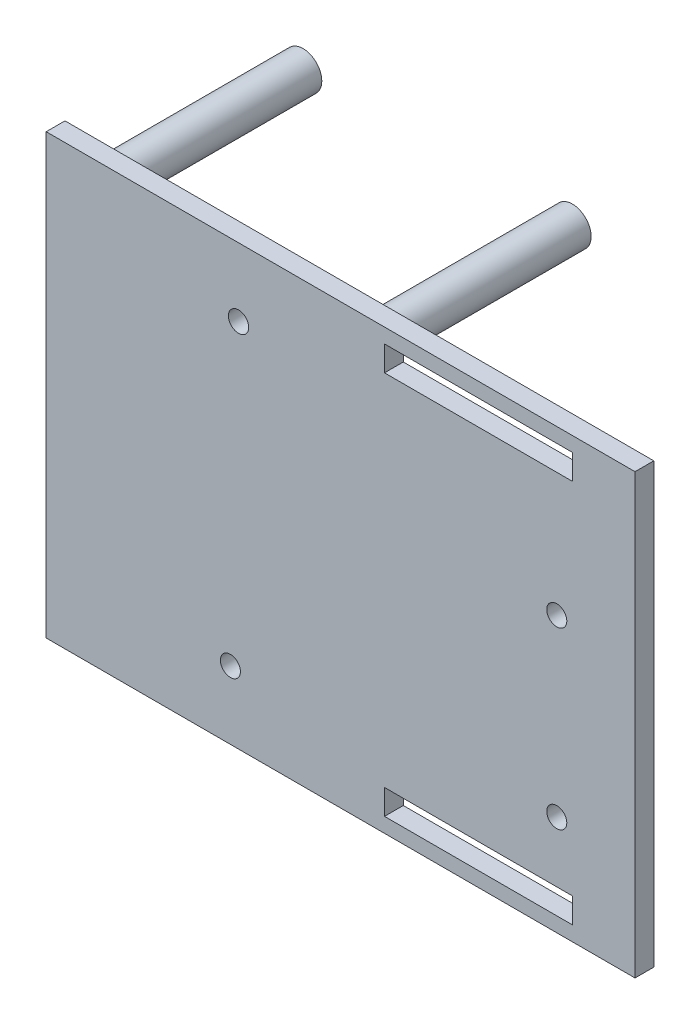
from build123d import *

# Parameters (mm, degrees)
SKETCH1_W           = 94
SKETCH1_H           = 70
BOSS_EXTRUDE2_DEPTH = 3
SKETCH3_R           = 3
BOSS_EXTRUDE5_DEPTH = 35
SKETCH7_R           = 1.602627629
CUT_EXTRUDE1_DEPTH  = 5
SKETCH8_R           = 1.6
CUT_EXTRUDE2_DEPTH  = 5
SKETCH9_R           = 1.6
CUT_EXTRUDE3_DEPTH  = 5
SKETCH10_W          = 30
SKETCH10_H          = 4
SKETCH10_R          = 1.6
SKETCH10_R_2        = 1.619244763
CUT_EXTRUDE5_DEPTH  = 5


with BuildPart() as part:
    # Sketch1 → Boss-Extrude2 (new body)
    with BuildSketch(Plane.XY):
        with Locations((47, 35)):
            Rectangle(SKETCH1_W, SKETCH1_H)
    extrude(amount=BOSS_EXTRUDE2_DEPTH)

    # Sketch3 → Boss-Extrude5 (add)
    with BuildSketch(Plane.XY.offset(3)):
        with Locations((49, 6)):
            Circle(SKETCH3_R)
        with Locations((49, 64)):
            Circle(SKETCH3_R)
        with Locations((6, 64)):
            Circle(SKETCH3_R)
    extrude(amount=-BOSS_EXTRUDE5_DEPTH)

    # Sketch7 → Cut-Extrude1 (cut)
    with BuildSketch(Plane(origin=(0, 0, -32), x_dir=(-1, 0, 0), z_dir=(0, 0, -1))):
        with Locations((-49, 6)):
            Circle(SKETCH7_R)
    extrude(amount=-CUT_EXTRUDE1_DEPTH, mode=Mode.SUBTRACT)

    # Sketch8 → Cut-Extrude2 (cut)
    with BuildSketch(Plane(origin=(0, 0, -32), x_dir=(-1, 0, 0), z_dir=(0, 0, -1))):
        with Locations((-6, 64)):
            Circle(SKETCH8_R)
    extrude(amount=-CUT_EXTRUDE2_DEPTH, mode=Mode.SUBTRACT)

    # Sketch9 → Cut-Extrude3 (cut)
    with BuildSketch(Plane(origin=(0, 0, -32), x_dir=(-1, 0, 0), z_dir=(0, 0, -1))):
        with Locations((-49, 64)):
            Circle(SKETCH9_R)
    extrude(amount=-CUT_EXTRUDE3_DEPTH, mode=Mode.SUBTRACT)

    # Sketch10 → Cut-Extrude5 (cut)
    with BuildSketch(Plane.XY.offset(3)):
        with Locations((69.008203537, 65.665805626)):
            Rectangle(SKETCH10_W, SKETCH10_H)
        with Locations((69.008203537, 4.35)):
            Rectangle(SKETCH10_W, SKETCH10_H)
        with Locations((29.408203537, 10.85)):
            Circle(SKETCH10_R)
        with Locations((81.508203537, 15.998164517)):
            Circle(SKETCH10_R)
        with Locations((81.508203537, 43.9)):
            Circle(SKETCH10_R)
        with Locations((30.708203537, 59.1)):
            Circle(SKETCH10_R_2)
    extrude(amount=-CUT_EXTRUDE5_DEPTH, mode=Mode.SUBTRACT)


solid = part.part
